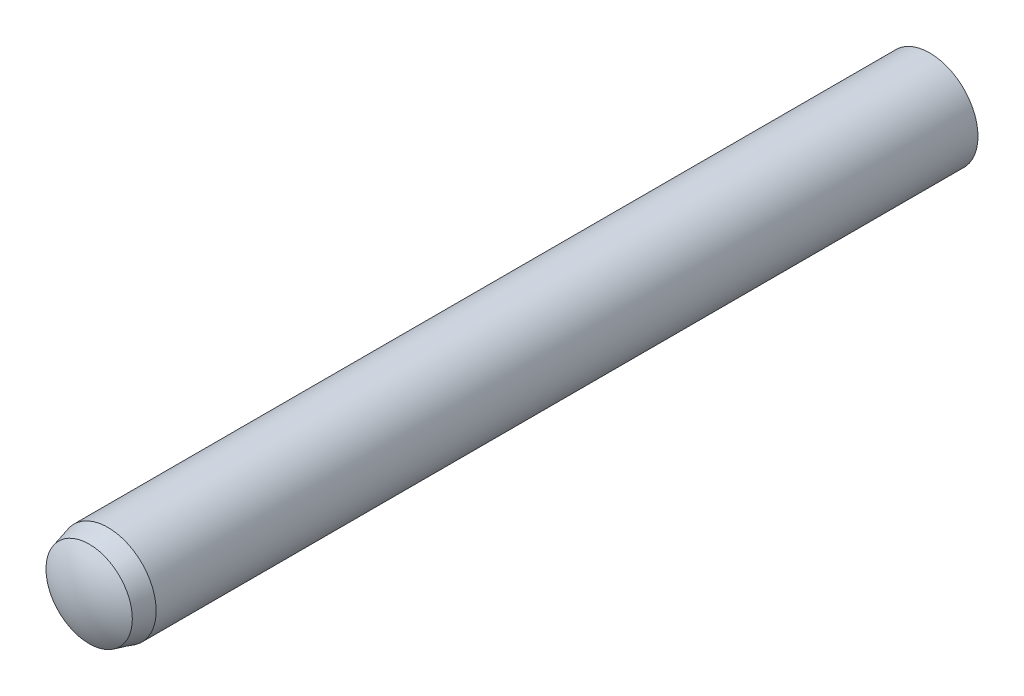
from build123d import *


with BuildPart() as part:
    # Sketch3 → Revolve1 (revolve)
    with BuildSketch(Plane(origin=(0, 0, 0), x_dir=(0, 0, -1), z_dir=(1, 0, 0))):
        with BuildLine():
            Line((-45, 0), (45, 0))
            ThreePointArc((45, 0), (44.616922091, 2.610076627), (43.5, 5))
            Line((43.5, 5), (-41.75, 5))
            Line((-41.75, 5), (-43.7, 4.477499075))
            ThreePointArc((-43.7, 4.477499075), (-44.668425132, 2.331201298), (-45, 0))
        make_face()
    revolve(axis=Axis((0, 0, 45), (0, 0, -1)))


solid = part.part
